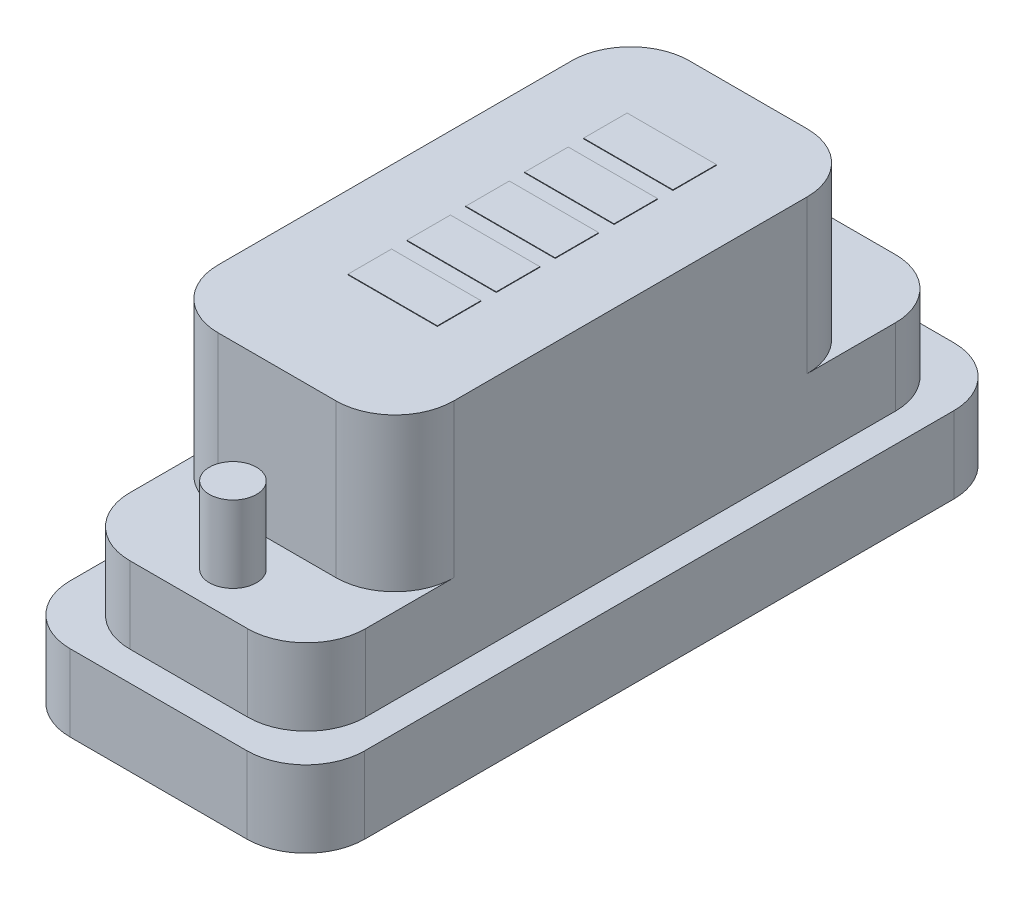
from build123d import *

# Parameters (mm, degrees)
SKETCH1_W           = 50
SKETCH1_H           = 120
BOSS_EXTRUDE1_DEPTH = 13
FILLET1_R           = 10
SKETCH6_W           = 40
SKETCH6_H           = 110
BOSS_EXTRUDE4_DEPTH = 13
SKETCH7_W           = 40
SKETCH7_H           = 80
BOSS_EXTRUDE5_DEPTH = 26
SKETCH8_R           = 4
BOSS_EXTRUDE6_DEPTH = 13
FILLET4_R           = 10
SKETCH9_W           = 15.181145945
SKETCH9_H           = 7.400808648
BOSS_EXTRUDE7_DEPTH = 0.1


with BuildPart() as part:
    # Sketch1 → Boss-Extrude1 (new body)
    with BuildSketch(Plane(origin=(0, 0, 0), x_dir=(1, 0, 0), z_dir=(0, 1, 0))):
        with Locations((25, 60)):
            Rectangle(SKETCH1_W, SKETCH1_H)
    extrude(amount=BOSS_EXTRUDE1_DEPTH)

    # Fillet1
    fillet1_edges = [part.edges().sort_by_distance(p)[0] for p in [
        (0, 6.5, -120),
        (50, 6.5, -120),
        (50, 6.5, 0),
        (0, 6.5, 0),
    ]]
    fillet(fillet1_edges, radius=FILLET1_R)

    # Sketch6 → Boss-Extrude4 (add)
    with BuildSketch(Plane(origin=(0, 13, 0), x_dir=(1, 0, 0), z_dir=(0, 1, 0))):
        with Locations((25.115018377, 60.006298816)):
            Rectangle(SKETCH6_W, SKETCH6_H)
    extrude(amount=BOSS_EXTRUDE4_DEPTH)

    # Sketch7 → Boss-Extrude5 (add)
    with BuildSketch(Plane(origin=(0, 26, 0), x_dir=(1, 0, 0), z_dir=(0, 1, 0))):
        with Locations((25.115018377, 60.006298816)):
            Rectangle(SKETCH7_W, SKETCH7_H)
    extrude(amount=BOSS_EXTRUDE5_DEPTH)

    # Sketch8 → Boss-Extrude6 (add)
    with BuildSketch(Plane(origin=(0, 26, 0), x_dir=(1, 0, 0), z_dir=(0, 1, 0))):
        with Locations(Location((25.115018377, 107.506298816, 0), (0, 0, 90))):
            Circle(SKETCH8_R)
        with Locations(Location((25.115018377, 12.506298816, 0), (0, 0, 90))):
            Circle(SKETCH8_R)
    extrude(amount=BOSS_EXTRUDE6_DEPTH)

    # Fillet4
    fillet4_edges = [part.edges().sort_by_distance(p)[0] for p in [
        (5.115018377, 19.5, -115.006298816),
        (5.115018377, 19.5, -5.006298816),
        (45.115018377, 19.5, -5.006298816),
        (45.115018377, 19.5, -115.006298816),
        (5.115018377, 39, -100.006298816),
        (5.115018377, 39, -20.006298816),
        (45.115018377, 39, -20.006298816),
        (45.115018377, 39, -100.006298816),
    ]]
    fillet(fillet4_edges, radius=FILLET4_R)

    # Sketch9 → Boss-Extrude7 (add)
    with BuildSketch(Plane(origin=(0, 52, 0), x_dir=(1, 0, 0), z_dir=(0, 1, 0))):
        with Locations((25.189764325, 73.246129728)):
            Rectangle(SKETCH9_W, SKETCH9_H)
        with Locations((25.189764325, 83.246129728)):
            Rectangle(SKETCH9_W, SKETCH9_H)
        with Locations((25.189764325, 63.246129728)):
            Rectangle(SKETCH9_W, SKETCH9_H)
        with Locations((25.189764325, 53.246129728)):
            Rectangle(SKETCH9_W, SKETCH9_H)
        with Locations((25.189764325, 43.246129728)):
            Rectangle(SKETCH9_W, SKETCH9_H)
    extrude(amount=BOSS_EXTRUDE7_DEPTH)


solid = part.part
